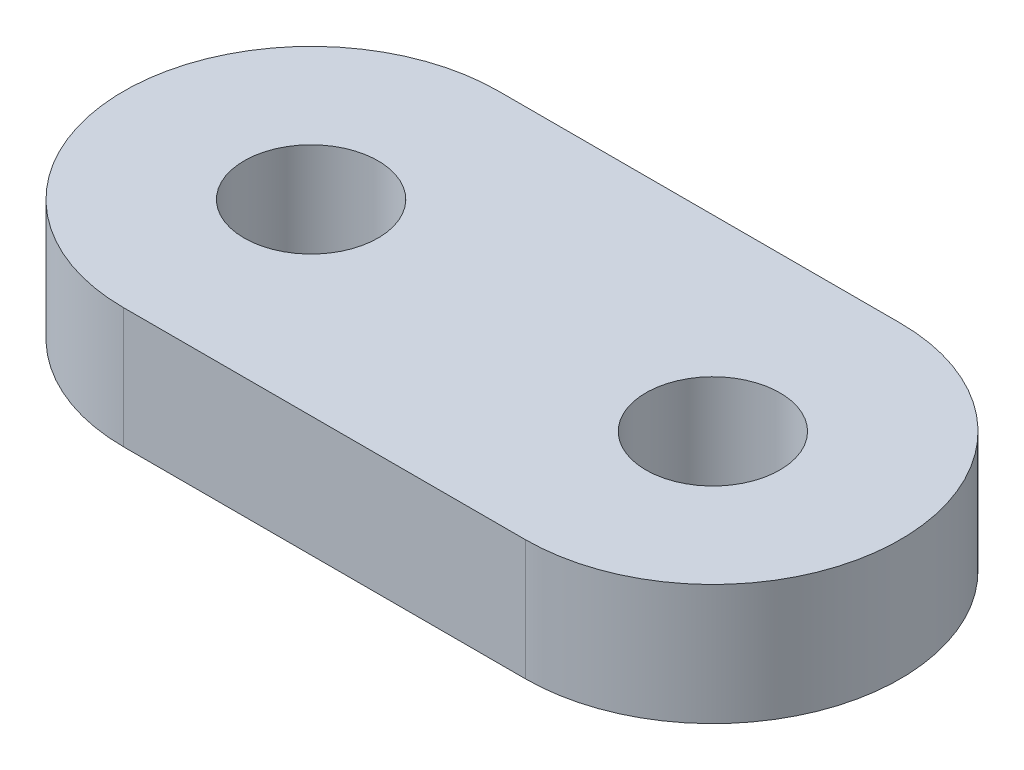
from build123d import *

# Parameters (mm, degrees)
SKETCH_1_R      = 2.5
EXTRUDE_1_DEPTH = 4.5


with BuildPart() as part:
    # Эскиз1 → Вытянуть1 (new body)
    with BuildSketch(Plane(origin=(0, 0, 0), x_dir=(1, 0, 0), z_dir=(0, 1, 0))):
        with BuildLine():
            Line((15, 7), (30, 7))
            ThreePointArc((30, 7), (37, 0), (30, -7))
            Line((30, -7), (15, -7))
            ThreePointArc((15, -7), (8, 0), (15, 7))
        make_face()
        with Locations(Location((15, 0, 0), (0, 0, 270))):
            Circle(SKETCH_1_R, mode=Mode.SUBTRACT)
        with Locations(Location((30, 0, 0), (0, 0, 270))):
            Circle(SKETCH_1_R, mode=Mode.SUBTRACT)
    extrude(amount=EXTRUDE_1_DEPTH)


solid = part.part
